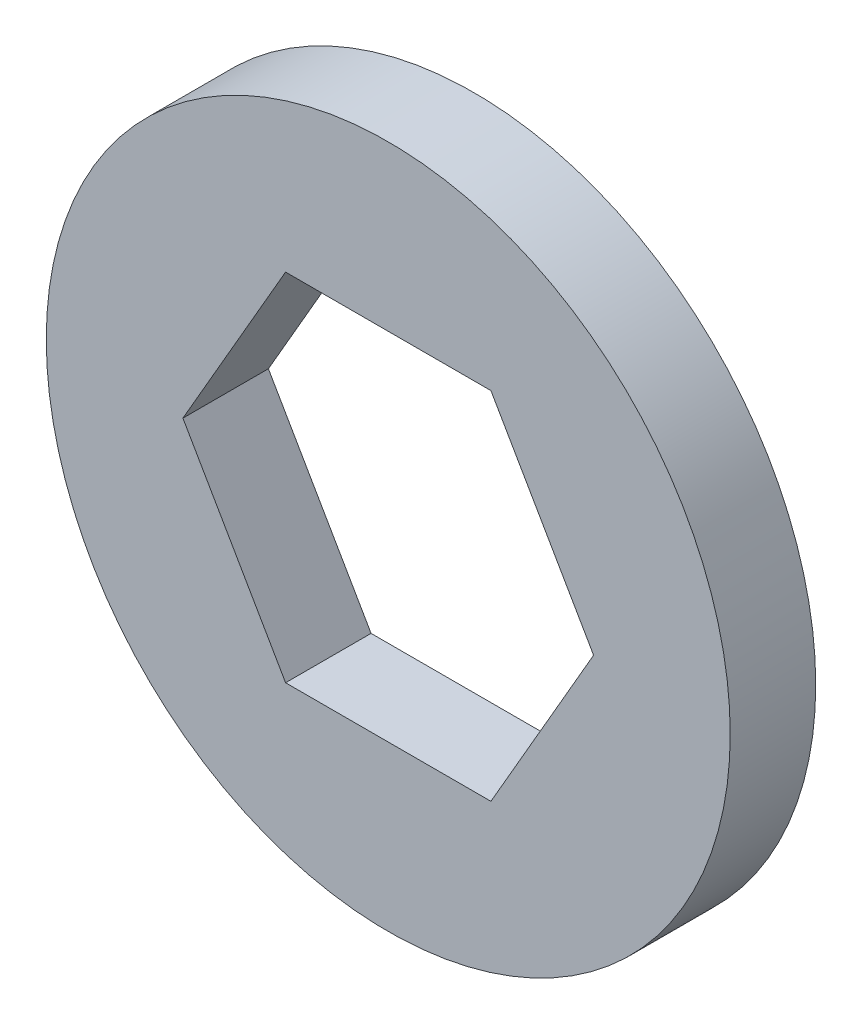
from build123d import *

# Parameters (mm, degrees)
SKETCH1_R           = 12.7
BOSS_EXTRUDE1_DEPTH = 3.175


with BuildPart() as part:
    # Sketch1 → Boss-Extrude1 (new body)
    with BuildSketch(Plane.XY):
        Circle(SKETCH1_R)
        Polygon((3.812821178, -6.604), (7.625642355, 0), (3.812821178, 6.604), (-3.812821178, 6.604), (-7.625642355, 0), (-3.812821178, -6.604), align=None, mode=Mode.SUBTRACT)
    extrude(amount=BOSS_EXTRUDE1_DEPTH)


solid = part.part
